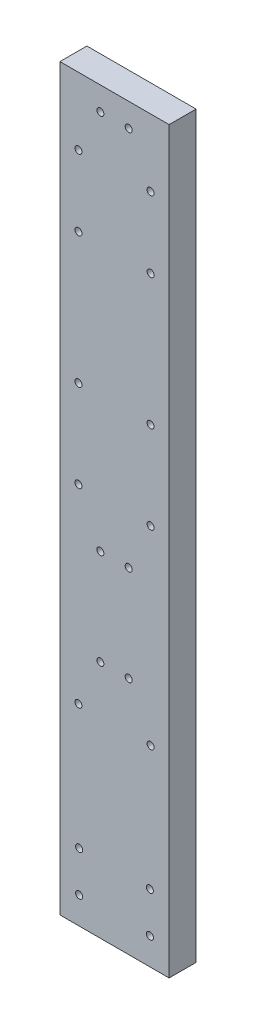
from build123d import *

# Parameters (mm, degrees)
SKETCH1_W           = 16.2
SKETCH1_H           = 109.64
SKETCH1_R           = 0.519960121
BOSS_EXTRUDE1_DEPTH = 4


with BuildPart() as part:
    # Sketch1 → Boss-Extrude1 (new body)
    with BuildSketch(Plane.XY):
        with Locations((8.1, 54.82)):
            Rectangle(SKETCH1_W, SKETCH1_H)
        with Locations((13.45, 56.71)):
            Circle(SKETCH1_R, mode=Mode.SUBTRACT)
        with Locations((10.2, 49.71)):
            Circle(SKETCH1_R, mode=Mode.SUBTRACT)
        with Locations(Location((10.2, 106.16, 0), (0, 0, 180))):
            Circle(SKETCH1_R, mode=Mode.SUBTRACT)
        with Locations((2.75, 99.66)):
            Circle(SKETCH1_R, mode=Mode.SUBTRACT)
        with Locations((6, 49.71)):
            Circle(SKETCH1_R, mode=Mode.SUBTRACT)
        with Locations((2.75, 28.5)):
            Circle(SKETCH1_R, mode=Mode.SUBTRACT)
        with Locations(Location((2.75, 89.16, 0), (0, 0, 180))):
            Circle(SKETCH1_R, mode=Mode.SUBTRACT)
        with Locations((2.75, 56.71)):
            Circle(SKETCH1_R, mode=Mode.SUBTRACT)
        with Locations(Location((13.45, 89.16, 0), (0, 0, 180))):
            Circle(SKETCH1_R, mode=Mode.SUBTRACT)
        with Locations(Location((13.45, 99.66, 0), (0, 0, 180))):
            Circle(SKETCH1_R, mode=Mode.SUBTRACT)
        with Locations((13.45, 69.71)):
            Circle(SKETCH1_R, mode=Mode.SUBTRACT)
        with Locations((6, 35.5)):
            Circle(SKETCH1_R, mode=Mode.SUBTRACT)
        with Locations((6, 106.16)):
            Circle(SKETCH1_R, mode=Mode.SUBTRACT)
        with Locations((10.2, 35.5)):
            Circle(SKETCH1_R, mode=Mode.SUBTRACT)
        with Locations((2.75, 69.71)):
            Circle(SKETCH1_R, mode=Mode.SUBTRACT)
        with Locations((13.45, 28.5)):
            Circle(SKETCH1_R, mode=Mode.SUBTRACT)
        with Locations((2.85, 10)):
            Circle(SKETCH1_R, mode=Mode.SUBTRACT)
        with Locations(Location((13.35, 10, 0), (0, 0, 180))):
            Circle(SKETCH1_R, mode=Mode.SUBTRACT)
        with Locations(Location((13.35, 4, 0), (0, 0, 180))):
            Circle(SKETCH1_R, mode=Mode.SUBTRACT)
        with Locations((2.85, 4)):
            Circle(SKETCH1_R, mode=Mode.SUBTRACT)
    extrude(amount=BOSS_EXTRUDE1_DEPTH)


solid = part.part
